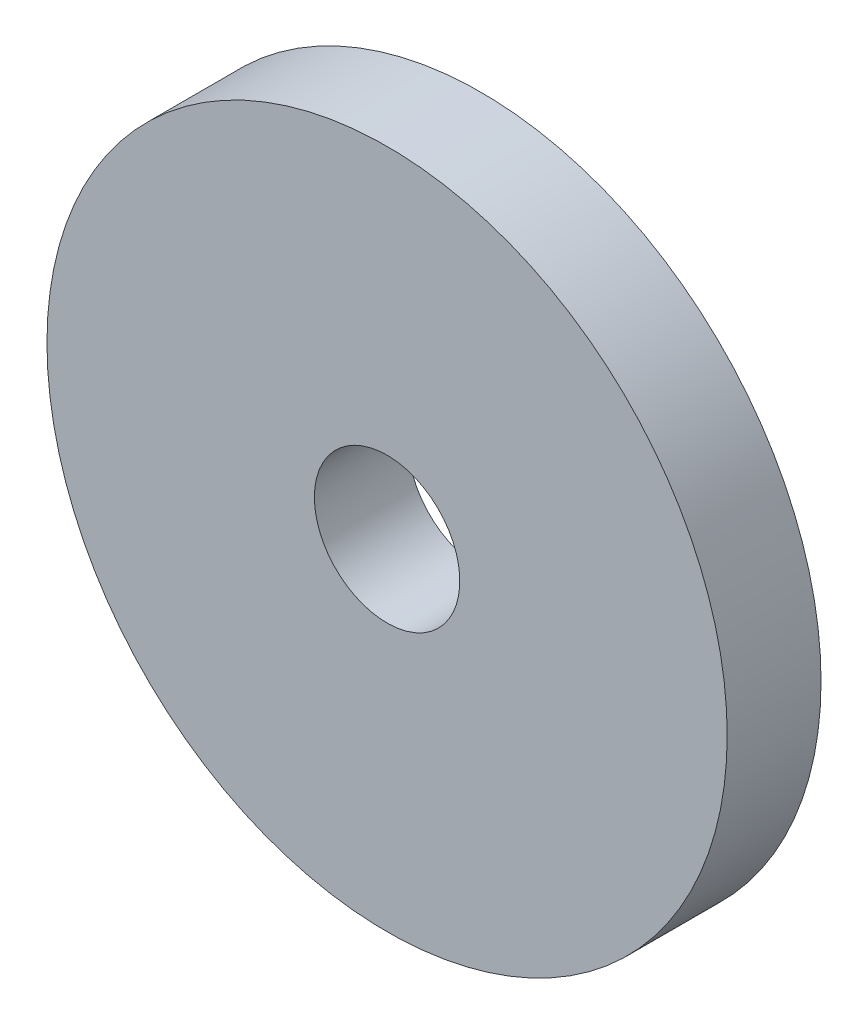
from build123d import *

# Parameters (mm, degrees)
SKETCH1_R           = 7.25
BOSS_EXTRUDE1_DEPTH = 2
SKETCH2_R           = 1.55
CUT_EXTRUDE1_DEPTH  = 2


with BuildPart() as part:
    # Sketch1 → Boss-Extrude1 (new body)
    with BuildSketch(Plane.XY):
        Circle(SKETCH1_R)
    extrude(amount=BOSS_EXTRUDE1_DEPTH)

    # Sketch2 → Cut-Extrude1 (cut)
    with BuildSketch(Plane(origin=(0, 0, 0), x_dir=(-1, 0, 0), z_dir=(0, 0, -1))):
        Circle(SKETCH2_R)
    extrude(amount=-CUT_EXTRUDE1_DEPTH, mode=Mode.SUBTRACT)


solid = part.part
